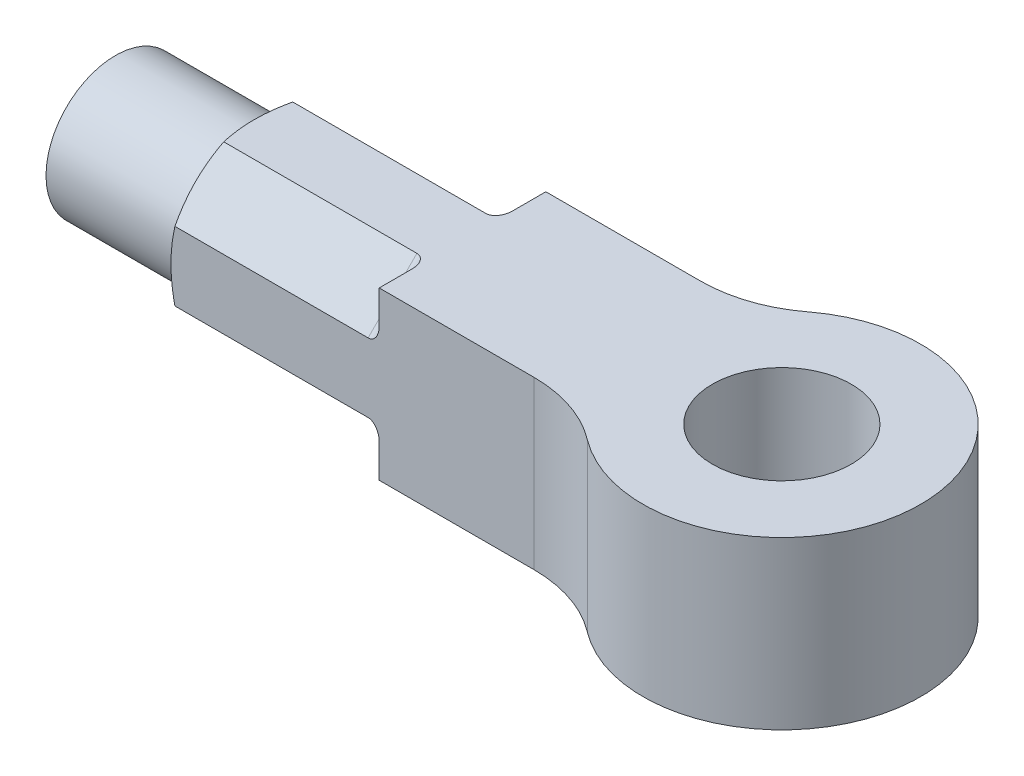
from build123d import *

# Parameters (mm, degrees)
SKETCH1_R           = 12.5
BOSS_EXTRUDE1_DEPTH = 15
SKETCH2_OUTSIDE_W   = 78.684
SKETCH2_OUTSIDE_H   = 58.684
CUT_EXTRUDE1_DEPTH  = 37.5
SKETCH3_R           = 12.5
BOSS_EXTRUDE2_DEPTH = 25
FILLET1_R           = 2


with BuildPart() as part:
    # Sketch1 → Boss-Extrude1 (new, symmetric)
    with BuildSketch(Plane(origin=(0, 0, 0), x_dir=(1, 0, 0), z_dir=(0, 1, 0))):
        with BuildLine():
            Line((-29.664793948, 15), (-95, 15))
            Line((-95, 15), (-95, -15))
            Line((-95, -15), (-29.664793948, -15))
            ThreePointArc((-29.664793948, -15), (-21.998275168, -16.257430009), (-15.135098953, -19.897959184))
            ThreePointArc((-15.135098953, -19.897959184), (25, 0), (-15.135098953, 19.897959184))
            ThreePointArc((-15.135098953, 19.897959184), (-21.998275168, 16.257430009), (-29.664793948, 15))
        make_face()
        with Locations(Location((0, 0, 0), (0, 0, 270))):
            Circle(SKETCH1_R, mode=Mode.SUBTRACT)
    extrude(amount=BOSS_EXTRUDE1_DEPTH, both=True)

    # Sketch2 outside → Cut-Extrude1 (cut)
    with BuildSketch(Plane.ZY.offset(95)):
        Rectangle(SKETCH2_OUTSIDE_W, SKETCH2_OUTSIDE_H)
        Polygon((6.213203436, 15), (-6.213203436, 15), (-15, 6.213203436), (-15, -6.213203436), (-6.213203436, -15), (6.213203436, -15), (15, -6.213203436), (15, 6.213203436), align=None, mode=Mode.SUBTRACT)
    extrude(amount=-CUT_EXTRUDE1_DEPTH, mode=Mode.SUBTRACT)

    # Sketch3 → Boss-Extrude2 (add)
    with BuildSketch(Plane.ZY.offset(95)):
        Circle(SKETCH3_R)
    extrude(amount=BOSS_EXTRUDE2_DEPTH)

    # Fillet1
    fillet1_edges = [part.edges().sort_by_distance(p)[0] for p in [
        (-57.5, 10.606601718, -10.606601718),
        (-57.5, -10.606601718, -10.606601718),
        (-57.5, 10.606601718, 10.606601718),
        (-57.5, -10.606601718, 10.606601718),
    ]]
    fillet(fillet1_edges, radius=FILLET1_R)

    # Sketch4 → Cut-Revolve1 (revolve, cut)
    with BuildSketch(Plane.XY):
        Polygon((-95, 15), (-95, 27.0023011), (-88.070468229, 27.0023011), align=None)
    revolve(axis=Axis((0, 0, 0), (-1, 0, 0)), mode=Mode.SUBTRACT)


solid = part.part
